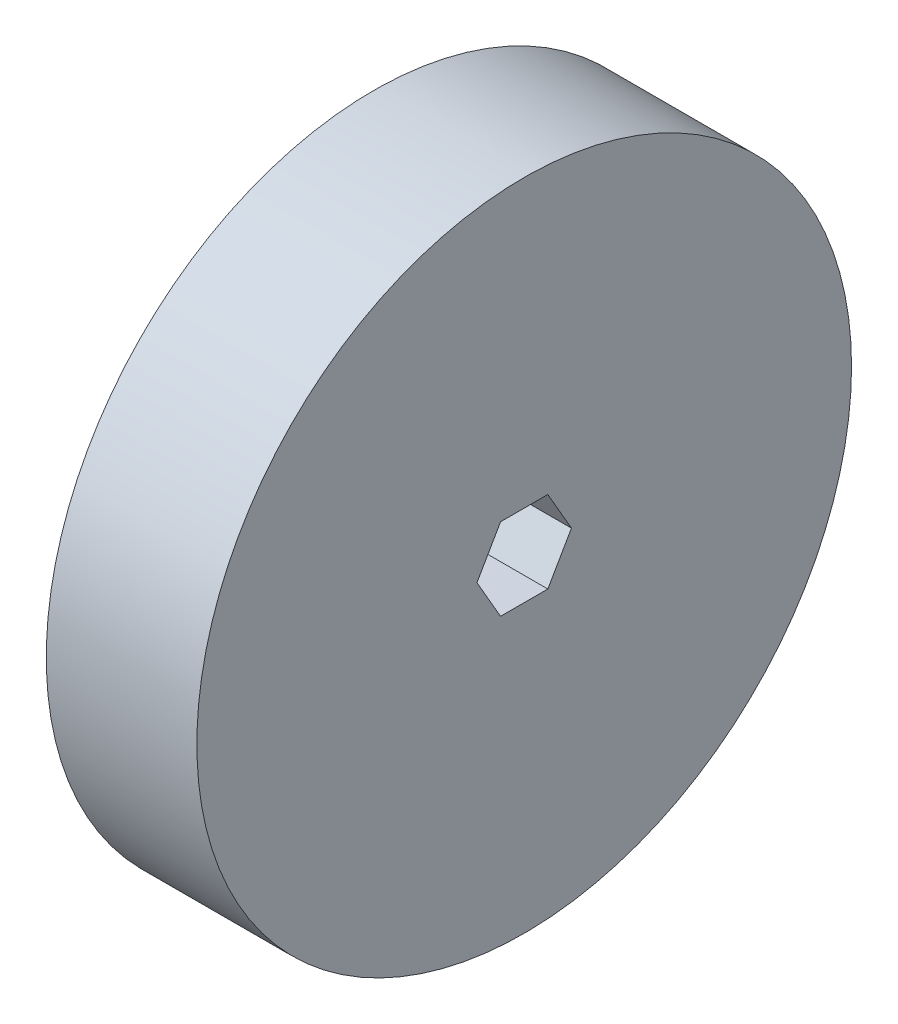
from build123d import *

# Parameters (mm, degrees)
SKETCH2_R           = 50.8
BOSS_EXTRUDE1_DEPTH = 23.368


with BuildPart() as part:
    # Sketch2 → Boss-Extrude1 (new body)
    with BuildSketch(Plane(origin=(0, 0, 0), x_dir=(0, 0, -1), z_dir=(1, 0, 0))):
        Circle(SKETCH2_R)
        Polygon((3.666174209, 6.35), (-3.666174209, 6.35), (-7.332348419, 0), (-3.666174209, -6.35), (3.666174209, -6.35), (7.332348419, 0), align=None, mode=Mode.SUBTRACT)
    extrude(amount=BOSS_EXTRUDE1_DEPTH)


solid = part.part
